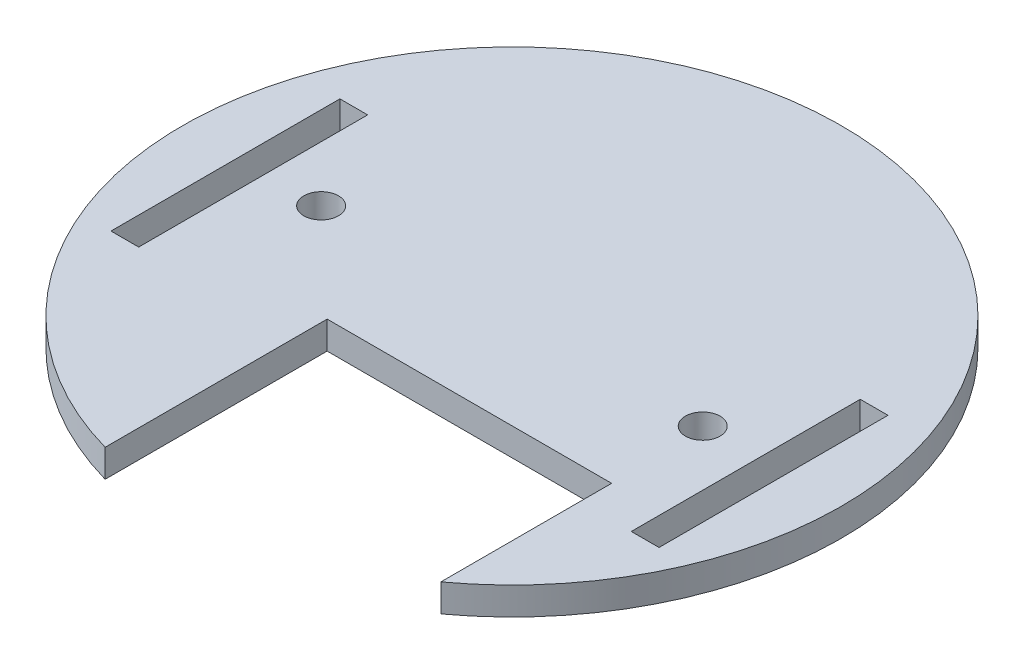
from build123d import *

# Parameters (mm, degrees)
SKETCH1_R           = 2.5
BOSS_EXTRUDE2_DEPTH = 4


with BuildPart() as part:
    # Sketch1 → Boss-Extrude2 (new body)
    with BuildSketch(Plane(origin=(0, 0, 0), x_dir=(1, 0, 0), z_dir=(0, 1, 0))):
        with BuildLine():
            Line((-12.928995443, -45.70657586), (-12.928995443, -13.70657586))
            Line((-12.928995443, -13.70657586), (28.071004557, -13.70657586))
            Line((28.071004557, -13.70657586), (28.071004557, -38.317994509))
            ThreePointArc((28.071004557, -38.317994509), (-8.424244393, 46.747001042), (-12.928995443, -45.70657586))
        make_face()
        with Locations(Location((-27.5, 0, 0), (0, 0, 270))):
            Circle(SKETCH1_R, mode=Mode.SUBTRACT)
        with Locations(Location((27.5, 0, 0), (0, 0, 90))):
            Circle(SKETCH1_R, mode=Mode.SUBTRACT)
        Polygon((35.5, -18.298658927), (39.5, -18.298658927), (39.5, 14.701341073), (35.5, 14.701341073), (35.5, 9.151429429), align=None, mode=Mode.SUBTRACT)
        Polygon((-35.5, -18.298658927), (-39.5, -18.298658927), (-39.5, 14.701341073), (-35.5, 14.701341073), (-35.5, 9.151429429), align=None, mode=Mode.SUBTRACT)
    extrude(amount=BOSS_EXTRUDE2_DEPTH)


solid = part.part
